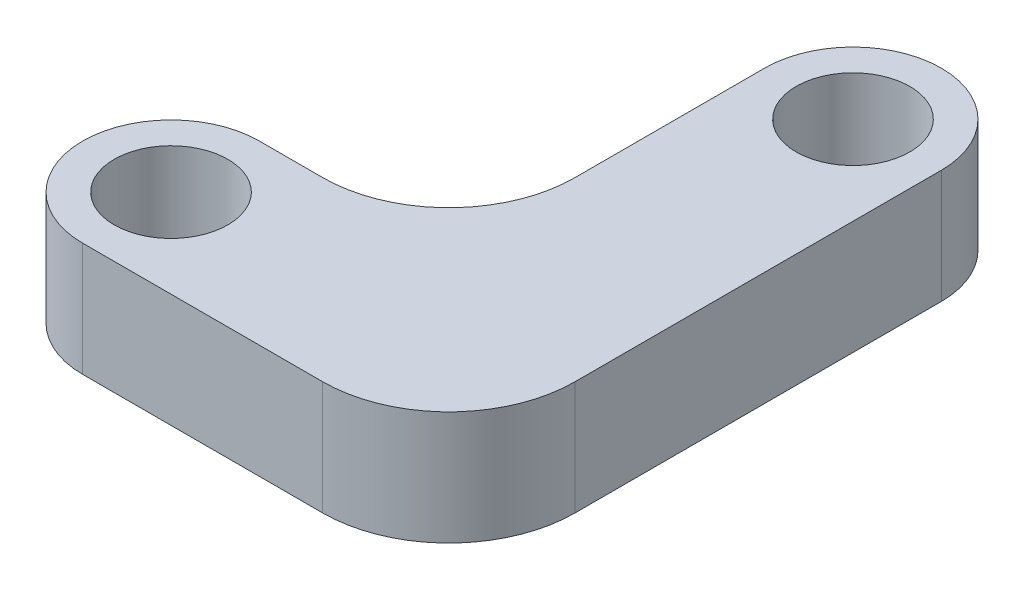
from build123d import *

# Parameters (mm, degrees)
EXTRUDE_1_DEPTH     = 25
EXTRUDE_2_DEPTH     = 9
SKETCH_3_R          = 4.5
CUT_EXTRUDE_1_DEPTH = 9
SKETCH_5_W          = 14
SKETCH_5_H          = 9
EXTRUDE_3_DEPTH     = 15
EXTRUDE_4_DEPTH     = 9
SKETCH_7_R          = 4.5
CUT_EXTRUDE_2_DEPTH = 9
SKETCH_8_W          = 14
SKETCH_8_H          = 14
EXTRUDE_5_DEPTH     = 9
FILLET_1_R          = 10


with BuildPart() as part:
    # 草图1 → 凸台-拉伸1 (new body)
    with BuildSketch(Plane.XY):
        Polygon((0, 0), (7, 0), (7, -9), (-7, -9), (-7, 0), align=None)
    extrude(amount=EXTRUDE_1_DEPTH)

    # 草图2 → 凸台-拉伸2 (add)
    with BuildSketch(Plane(origin=(0, 0, 0), x_dir=(1, 0, 0), z_dir=(0, 1, 0))):
        with BuildLine():
            Line((7, 0), (-7, 0))
            ThreePointArc((-7, 0), (0, 7), (7, 0))
        make_face()
    extrude(amount=-EXTRUDE_2_DEPTH)

    # 草图3 → 切除-拉伸1 (cut)
    with BuildSketch(Plane(origin=(0, 0, 0), x_dir=(1, 0, 0), z_dir=(0, 1, 0))):
        with Locations(Location((0, 0, 0), (0, 0, 270))):
            Circle(SKETCH_3_R)
    extrude(amount=-CUT_EXTRUDE_1_DEPTH, mode=Mode.SUBTRACT)



with BuildPart() as body_2:
    # 草图5 → 凸台-拉伸3 (new body)
    with BuildSketch(Plane.ZY.offset(7)):
        with Locations((32, -4.5)):
            Rectangle(SKETCH_5_W, SKETCH_5_H)
    extrude(amount=EXTRUDE_3_DEPTH)

    # 草图6 → 凸台-拉伸4 (add)
    with BuildSketch(Plane(origin=(0, 0, 0), x_dir=(1, 0, 0), z_dir=(0, 1, 0))):
        with BuildLine():
            Line((-22, -25), (-22, -39))
            ThreePointArc((-22, -39), (-29, -32), (-22, -25))
        make_face()
    extrude(amount=-EXTRUDE_4_DEPTH)

    # 草图7 → 切除-拉伸2 (cut)
    with BuildSketch(Plane(origin=(0, 0, 0), x_dir=(1, 0, 0), z_dir=(0, 1, 0))):
        with Locations(Location((-22, -32, 0), (0, 0, 270))):
            Circle(SKETCH_7_R)
    extrude(amount=-CUT_EXTRUDE_2_DEPTH, mode=Mode.SUBTRACT)


with BuildPart() as part_1:
    add(part.part)

    add(body_2.part)  # 凸台-拉伸5 merges body 2
    # 草图8 → 凸台-拉伸5 (add)
    with BuildSketch(Plane(origin=(0, 0, 0), x_dir=(1, 0, 0), z_dir=(0, 1, 0))):
        with Locations((0, -32)):
            Rectangle(SKETCH_8_W, SKETCH_8_H)
    extrude(amount=-EXTRUDE_5_DEPTH)

    # 圆角1
    fillet_1_edges = [part_1.edges().sort_by_distance(p)[0] for p in [
        (7, -4.5, 39),
        (-7, -4.5, 25),
    ]]
    fillet(fillet_1_edges, radius=FILLET_1_R)


solid = part_1.part
